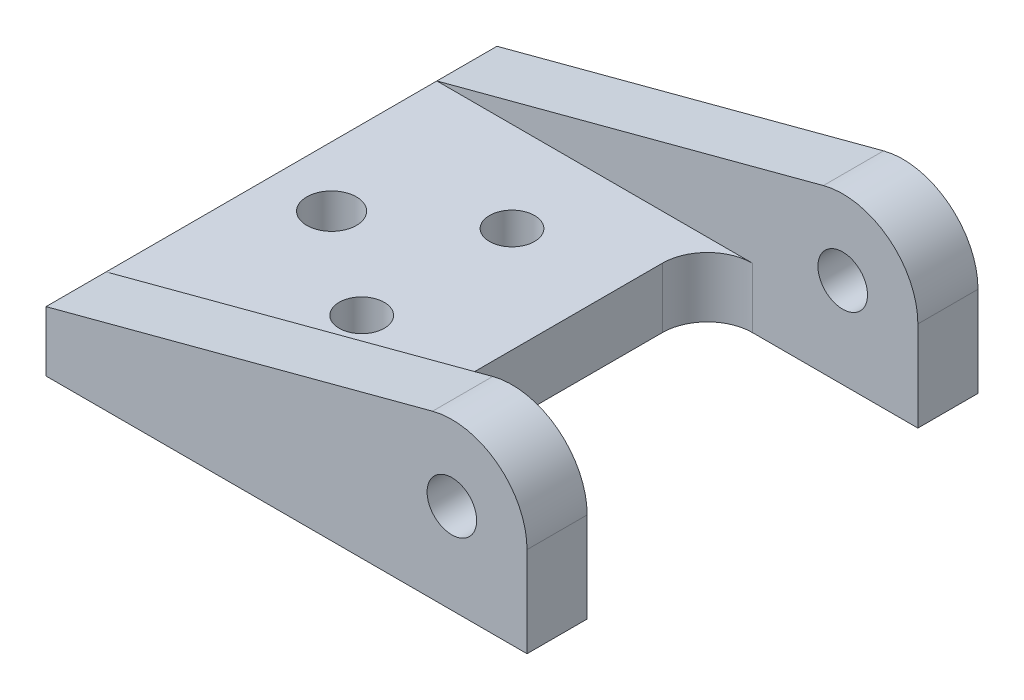
from build123d import *

# Parameters (mm, degrees)
SKETCH_1_R          = 1.65
EXTRUDE_1_DEPTH     = 30
SKETCH_2_W          = 14
SKETCH_2_H          = 22
CUT_EXTRUDE_1_DEPTH = 30
SKETCH_3_W          = 18
SKETCH_3_H          = 22
CUT_EXTRUDE_2_DEPTH = 30
FILLET_1_R          = 3
SKETCH_4_R          = 1.65
CUT_EXTRUDE_3_DEPTH = 30
SKETCH_5_R          = 1.5
CUT_EXTRUDE_4_DEPTH = 45.418464629


with BuildPart() as part:
    # 草图1 → 凸台-拉伸1 (new body)
    with BuildSketch(Plane.XY):
        with BuildLine():
            Line((0, 0), (32, 0))
            Line((32, 0), (32, 6))
            ThreePointArc((32, 6), (30.048000097, 9.963545813), (25.716121836, 10.832355208))
            Line((25.716121836, 10.832355208), (0, 4))
            Line((0, 4), (0, 0))
        make_face()
        with Locations((27, 6)):
            Circle(SKETCH_1_R, mode=Mode.SUBTRACT)
    extrude(amount=EXTRUDE_1_DEPTH)

    # 草图2 → 切除-拉伸1 (cut)
    with BuildSketch(Plane.XZ):
        with Locations((25, 15)):
            Rectangle(SKETCH_2_W, SKETCH_2_H)
    extrude(amount=-CUT_EXTRUDE_1_DEPTH, mode=Mode.SUBTRACT)

    # 草图3 → 切除-拉伸2 (cut)
    with BuildSketch(Plane(origin=(0, 4, 0), x_dir=(-1, 0, 0), z_dir=(0, -1, 0))):
        with Locations((-9, -15)):
            Rectangle(SKETCH_3_W, SKETCH_3_H)
    extrude(amount=-CUT_EXTRUDE_2_DEPTH, mode=Mode.SUBTRACT)

    # 圆角1
    fillet_1_edges = [part.edges().sort_by_distance(p)[0] for p in [
        (18, 2, 26),
        (18, 2, 4),
    ]]
    fillet(fillet_1_edges, radius=FILLET_1_R)

    # 草图4 → 切除-拉伸3 (cut)
    with BuildSketch(Plane(origin=(0, 4, 0), x_dir=(1, 0, 0), z_dir=(0, 1, 0))):
        with Locations(Location((4, -15, 0), (0, 0, 270))):
            Circle(SKETCH_4_R)
    extrude(amount=-CUT_EXTRUDE_3_DEPTH, mode=Mode.SUBTRACT)

    # 草图5 → 切除-拉伸4 (cut, through all)
    with BuildSketch(Plane(origin=(0, 4, 0), x_dir=(1, 0, 0), z_dir=(0, 1, 0))):
        with Locations(Location((11, -10, 0), (0, 0, 270))):
            Circle(SKETCH_5_R)
        with Locations(Location((11, -20, 0), (0, 0, 270))):
            Circle(SKETCH_5_R)
    extrude(amount=-CUT_EXTRUDE_4_DEPTH, mode=Mode.SUBTRACT)


solid = part.part
